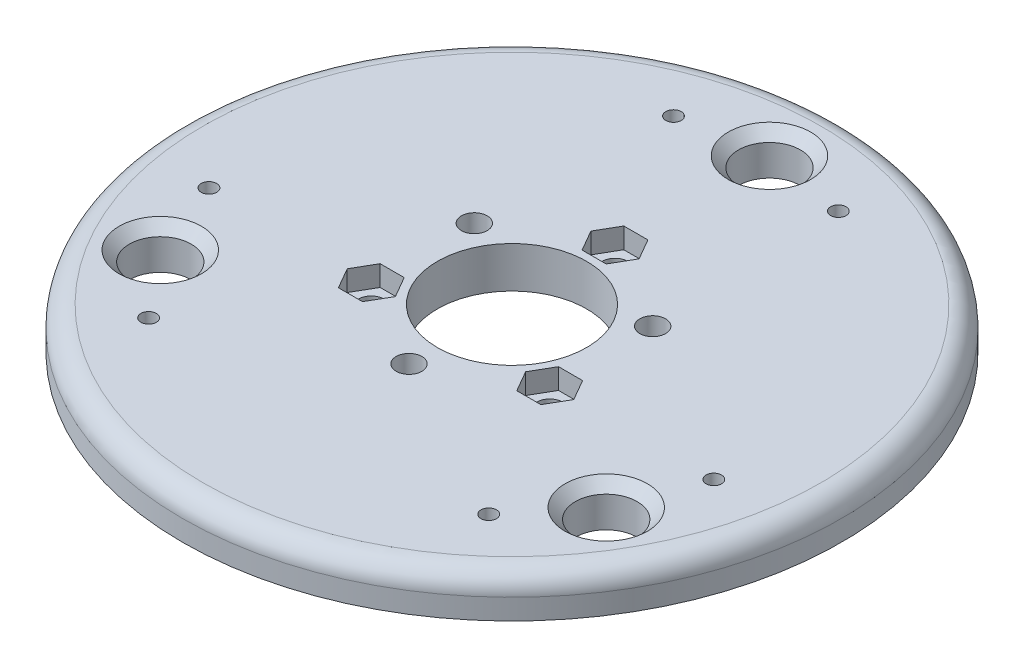
from build123d import *

# Parameters (mm, degrees)
SKETCH_1_R          = 32
SKETCH_1_R_2        = 7.25
SKETCH_1_R_3        = 3
EXTRUDE_1_DEPTH     = 4
FILLET_1_R          = 2
SKETCH_2_R          = 1.25
CUT_EXTRUDE_1_DEPTH = 46.431266766
CUT_EXTRUDE_2_DEPTH = 2
CUT_EXTRUDE_3_DEPTH = 2
CHAMFER_1_SIZE      = 1
SKETCH_5_R          = 0.75
CUT_EXTRUDE_4_DEPTH = 46.431266766


with BuildPart() as part:
    # Эскиз1 → Бобышка-Вытянуть1 (new body)
    with BuildSketch(Plane(origin=(0, 0, 0), x_dir=(1, 0, 0), z_dir=(0, 1, 0))):
        with Locations(Location((0, 0, 0), (0, 0, 270))):
            Circle(SKETCH_1_R)
        with Locations(Location((0, 0, 0), (0, 0, 270))):
            Circle(SKETCH_1_R_2, mode=Mode.SUBTRACT)
        with Locations(Location((0, 25, 0), (0, 0, 270))):
            Circle(SKETCH_1_R_3, mode=Mode.SUBTRACT)
        with Locations(Location((21.650635095, -12.5, 0), (0, 0, 270))):
            Circle(SKETCH_1_R_3, mode=Mode.SUBTRACT)
        with Locations(Location((-21.650635095, -12.5, 0), (0, 0, 270))):
            Circle(SKETCH_1_R_3, mode=Mode.SUBTRACT)
    extrude(amount=EXTRUDE_1_DEPTH)

    # Скругление1
    fillet_1_edges = [part.edges().sort_by_distance(p)[0] for p in [
        (0, 4, -32),
    ]]
    fillet(fillet_1_edges, radius=FILLET_1_R)

    # Эскиз2 → Вырез-Вытянуть1 (cut, through all)
    with BuildSketch(Plane(origin=(0, 4, 0), x_dir=(1, 0, 0), z_dir=(0, 1, 0))):
        with Locations(Location((0, 10, 0), (0, 0, 270))):
            Circle(SKETCH_2_R)
        with Locations(Location((8.660254038, 5, 0), (0, 0, 270))):
            Circle(SKETCH_2_R)
        with Locations(Location((8.660254038, -5, 0), (0, 0, 270))):
            Circle(SKETCH_2_R)
        with Locations(Location((0, -10, 0), (0, 0, 270))):
            Circle(SKETCH_2_R)
        with Locations(Location((-8.660254038, -5, 0), (0, 0, 270))):
            Circle(SKETCH_2_R)
        with Locations(Location((-8.660254038, 5, 0), (0, 0, 270))):
            Circle(SKETCH_2_R)
    extrude(amount=-CUT_EXTRUDE_1_DEPTH, mode=Mode.SUBTRACT)

    # Эскиз3 → Вырез-Вытянуть2 (cut)
    with BuildSketch(Plane(origin=(0, 4, 0), x_dir=(1, 0, 0), z_dir=(0, 1, 0))):
        Polygon((9.829388333, -7.025), (10.998522628, -5), (9.829388333, -2.975), (7.491119743, -2.975), (6.321985448, -5), (7.491119743, -7.025), align=None)
        Polygon((1.169134295, 7.975), (2.33826859, 10), (1.169134295, 12.025), (-1.169134295, 12.025), (-2.33826859, 10), (-1.169134295, 7.975), align=None)
        Polygon((-10.998522628, -5), (-9.829388333, -7.025), (-7.491119743, -7.025), (-6.321985448, -5), (-7.491119743, -2.975), (-9.829388333, -2.975), align=None)
    extrude(amount=-CUT_EXTRUDE_2_DEPTH, mode=Mode.SUBTRACT)

    # Эскиз4 → Вырез-Вытянуть3 (cut)
    with BuildSketch(Plane.XZ):
        Polygon((7.491119743, -7.025), (9.829388333, -7.025), (10.998522628, -5), (9.829388333, -2.975), (7.491119743, -2.975), (6.321985448, -5), align=None)
        Polygon((-1.169134295, 7.975), (1.169134295, 7.975), (2.33826859, 10), (1.169134295, 12.025), (-1.169134295, 12.025), (-2.33826859, 10), align=None)
        Polygon((-9.829388333, -2.975), (-10.998522628, -5), (-9.829388333, -7.025), (-7.491119743, -7.025), (-6.321985448, -5), (-7.491119743, -2.975), align=None)
    extrude(amount=-CUT_EXTRUDE_3_DEPTH, mode=Mode.SUBTRACT)

    # Фаска1
    chamfer_1_edges = [part.edges().sort_by_distance(p)[0] for p in [
        (21.650635095, 4, 9.5),
        (-21.650635095, 4, 9.5),
        (0, 4, -28),
    ]]
    chamfer(chamfer_1_edges, length=CHAMFER_1_SIZE)

    # Эскиз5 → Вырез-Вытянуть4 (cut, through all)
    with BuildSketch(Plane(origin=(0, 4, 0), x_dir=(1, 0, 0), z_dir=(0, 1, 0))):
        with Locations(Location((8, 23.685438565, 0), (0, 0, 270))):
            Circle(SKETCH_5_R)
        with Locations(Location((-8, 23.685438565, 0), (0, 0, 270))):
            Circle(SKETCH_5_R)
        with Locations(Location((24.512191497, -4.914516052, 0), (0, 0, 270))):
            Circle(SKETCH_5_R)
        with Locations(Location((16.512191497, -18.770922513, 0), (0, 0, 270))):
            Circle(SKETCH_5_R)
        with Locations(Location((-16.512191497, -18.770922513, 0), (0, 0, 270))):
            Circle(SKETCH_5_R)
        with Locations(Location((-24.512191497, -4.914516052, 0), (0, 0, 270))):
            Circle(SKETCH_5_R)
    extrude(amount=-CUT_EXTRUDE_4_DEPTH, mode=Mode.SUBTRACT)


solid = part.part
